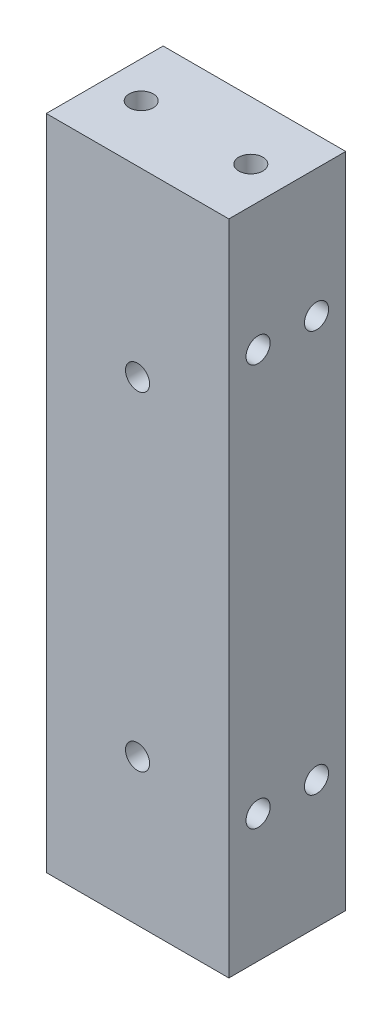
from build123d import *

# Parameters (mm, degrees)
SKETCH1_W                      = 25
SKETCH1_H                      = 16
BOSS_EXTRUDE1_DEPTH            = 90
M4X0_7_TAPPED_HOLE1_D          = 3.3
M4X0_7_TAPPED_HOLE1_DEPTH      = 8
M4X0_7_TAPPED_HOLE1_TIP        = 0.991420021
M4X0_7_TAPPED_HOLE2_D          = 3.3
M4X0_7_TAPPED_HOLE2_DEPTH      = 12
M4X0_7_TAPPED_HOLE2_TIP        = 0.991420021
M4X0_7_TAPPED_HOLE3_D          = 3.3
M4X0_7_TAPPED_HOLE4_AT_2_COUNT = 2
M4X0_7_TAPPED_HOLE4_AT_2_PITCH = 55.578772926
M4X0_7_TAPPED_HOLE4_AT_3_COUNT = 2
M4X0_7_TAPPED_HOLE4_AT_3_PITCH = 55
M4X0_7_TAPPED_HOLE4_AT_4_COUNT = 2
M4X0_7_TAPPED_HOLE4_AT_4_PITCH = 8


with BuildPart() as part:
    # Sketch1 → Boss-Extrude1 (new body)
    with BuildSketch(Plane(origin=(0, 0, 0), x_dir=(1, 0, 0), z_dir=(0, 1, 0))):
        Rectangle(SKETCH1_W, SKETCH1_H)
    extrude(amount=BOSS_EXTRUDE1_DEPTH)

    # M4x0.7 Tapped Hole1
    with Locations(Plane(origin=(0, 90, 0), x_dir=(1, 0, 0), z_dir=(0, 1, 0))):
        with Locations((-7.5, 0), (7.5, 0)):
            Hole(M4X0_7_TAPPED_HOLE1_D / 2, depth=M4X0_7_TAPPED_HOLE1_DEPTH)
            with Locations((0, 0, -(M4X0_7_TAPPED_HOLE1_DEPTH + M4X0_7_TAPPED_HOLE1_TIP / 2))):  # 118° drill point
                Cone(0, M4X0_7_TAPPED_HOLE1_D / 2, M4X0_7_TAPPED_HOLE1_TIP, mode=Mode.SUBTRACT)

    # M4x0.7 Tapped Hole2
    with Locations(Plane(origin=(0, 0, 0), x_dir=(-1, 0, 0), z_dir=(0, -1, 0))):
        with Locations((-7.5, 0), (7.5, 0)):
            Hole(M4X0_7_TAPPED_HOLE2_D / 2, depth=M4X0_7_TAPPED_HOLE2_DEPTH)
            with Locations((0, 0, -(M4X0_7_TAPPED_HOLE2_DEPTH + M4X0_7_TAPPED_HOLE2_TIP / 2))):  # 118° drill point
                Cone(0, M4X0_7_TAPPED_HOLE2_D / 2, M4X0_7_TAPPED_HOLE2_TIP, mode=Mode.SUBTRACT)

    # M4x0.7 Tapped Hole3 (through all)
    with Locations(Plane(origin=(0, 0, -8), x_dir=(-1, 0, 0), z_dir=(0, 0, -1))):
        with Locations((0, 20), (0, 65), (15, 65), (15, 20)):
            Hole(M4X0_7_TAPPED_HOLE3_D / 2)

    # Sketch13 → M4x0.7 Tapped Hole4 (revolve, cut)
    with BuildSketch(Plane(origin=(-12.5, 17.5, 4), x_dir=(0, 0, 1), z_dir=(0, 1, 0))):
        Polygon((0, 0), (0, 8.991420021), (1.65, 8), (1.65, 0), align=None)
    m4x0_7_tapped_hole4 = revolve(axis=Axis((-18.85, 17.5, 4), (1, 0, 0)), mode=Mode.SUBTRACT)

    # M4x0.7 Tapped Hole4 at 2: M4x0.7 Tapped Hole4 ×2
    with Locations(*[Vector(0, 0.9895864392845114, -0.14393984571411075) * (i * M4X0_7_TAPPED_HOLE4_AT_2_PITCH) for i in range(1, M4X0_7_TAPPED_HOLE4_AT_2_COUNT)]):
        add(m4x0_7_tapped_hole4, mode=Mode.SUBTRACT)

    # M4x0.7 Tapped Hole4 at 3: M4x0.7 Tapped Hole4 ×2
    with Locations(*[(0, i * M4X0_7_TAPPED_HOLE4_AT_3_PITCH, 0) for i in range(1, M4X0_7_TAPPED_HOLE4_AT_3_COUNT)]):
        add(m4x0_7_tapped_hole4, mode=Mode.SUBTRACT)

    # M4x0.7 Tapped Hole4 at 4: M4x0.7 Tapped Hole4 ×2
    with Locations(*[(0, 0, -i * M4X0_7_TAPPED_HOLE4_AT_4_PITCH) for i in range(1, M4X0_7_TAPPED_HOLE4_AT_4_COUNT)]):
        add(m4x0_7_tapped_hole4, mode=Mode.SUBTRACT)

    # Mirror1: M4x0.7 Tapped Hole4 across plane
    add(m4x0_7_tapped_hole4.mirror(Plane(origin=(0, 0, 0), x_dir=(0, 0, 1), z_dir=(1, 0, 0))), mode=Mode.SUBTRACT)

    # Mirror1 copy 1 sketch → Mirror1 copy 1 (revolve, cut)
    with BuildSketch(Plane(origin=(12.5, 72.5, -4), x_dir=(0, 0, 1), z_dir=(0, 1, 0))):
        Polygon((0, 0), (0, -8.991420021), (1.65, -8), (1.65, 0), align=None)
    revolve(axis=Axis((18.85, 72.5, -4), (1, 0, 0)), mode=Mode.SUBTRACT)

    # Mirror1 copy 2 sketch → Mirror1 copy 2 (revolve, cut)
    with BuildSketch(Plane(origin=(12.5, 72.5, 4), x_dir=(0, 0, 1), z_dir=(0, 1, 0))):
        Polygon((0, 0), (0, -8.991420021), (1.65, -8), (1.65, 0), align=None)
    revolve(axis=Axis((18.85, 72.5, 4), (1, 0, 0)), mode=Mode.SUBTRACT)

    # Mirror1 copy 3 sketch → Mirror1 copy 3 (revolve, cut)
    with BuildSketch(Plane(origin=(12.5, 17.5, -4), x_dir=(0, 0, 1), z_dir=(0, 1, 0))):
        Polygon((0, 0), (0, -8.991420021), (1.65, -8), (1.65, 0), align=None)
    revolve(axis=Axis((18.85, 17.5, -4), (1, 0, 0)), mode=Mode.SUBTRACT)


solid = part.part
